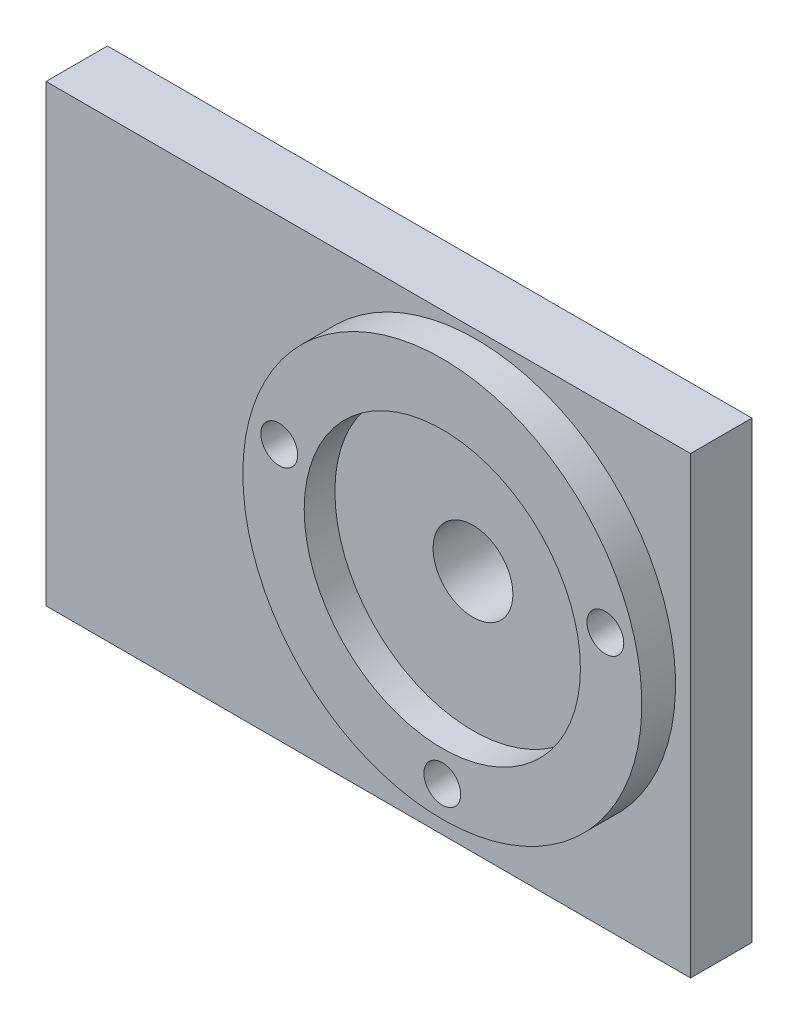
from build123d import *

# Parameters (mm, degrees)
ESQUISSE1_R                                  = 32.5
BOSS_EXTRU_1_DEPTH                           = 5
ESQUISSE2_R                                  = 22.5
ENL_V_MAT_EXTRU_1_DEPTH                      = 2.5
ESQUISSE3_R                                  = 6.5
ENL_V_MAT_EXTRU_2_DEPTH                      = 47.029881599
TROUS_DE_CENTRAGE_6_0MM1_D                   = 6
ESQUISSE6_W                                  = 105
ESQUISSE6_H                                  = 74
ESQUISSE6_R                                  = 32.5
BOSS_EXTRU_2_DEPTH                           = 10
ESQUISSE7_R                                  = 32.5
ESQUISSE7_R_2                                = 3
ESQUISSE7_R_3                                = 22.5
BOSS_EXTRU_3_DEPTH                           = 10.5
CHAMBRAGE_POUR_VIS_T_TE_RONDE_BOMB_2_COUNT   = 2
CHAMBRAGE_POUR_VIS_T_TE_RONDE_BOMB_2_PITCH   = 43.634433716
CHAMBRAGE_POUR_VIS_T_TE_RONDE_BOMB_3_COUNT   = 2
CHAMBRAGE_POUR_VIS_T_TE_RONDE_BOMB_3_PITCH   = 43.634433716
ESQUISSE16_R                                 = 6.5
BOSS_EXTRU_4_DEPTH                           = 8
CHAMBRAGE_POUR_VIS_T_TE_RONDE_BOMB_5_A_COUNT = 2
CHAMBRAGE_POUR_VIS_T_TE_RONDE_BOMB_5_A_PITCH = 43.634433716
D_GAGEMENT_M33_D                             = 3.4
D_GAGEMENT_M33_DEPTH                         = 5
D_GAGEMENT_M33_TIP                           = 0.981495458
D_GAGEMENT_M42_D                             = 4.5
D_GAGEMENT_M42_DEPTH                         = 5
D_GAGEMENT_M42_TIP                           = 1.299038106
D_GAGEMENT_M43_D                             = 4.5
D_GAGEMENT_M43_DEPTH                         = 5
D_GAGEMENT_M43_TIP                           = 1.299038106
D_GAGEMENT_M44_D                             = 4.5
D_GAGEMENT_M44_DEPTH                         = 5
D_GAGEMENT_M44_TIP                           = 1.299038106
D_GAGEMENT_M45_D                             = 4.5
D_GAGEMENT_M45_DEPTH                         = 3
D_GAGEMENT_M45_TIP                           = 1.299038106


with BuildPart() as part:
    # Esquisse1 → Boss.-Extru.1 (new body)
    with BuildSketch(Plane.XY):
        Circle(ESQUISSE1_R)
    extrude(amount=BOSS_EXTRU_1_DEPTH)

    # Esquisse2 → Enlèv. mat.-Extru.1 (cut)
    with BuildSketch(Plane.XY.offset(5)):
        Circle(ESQUISSE2_R)
    extrude(amount=-ENL_V_MAT_EXTRU_1_DEPTH, mode=Mode.SUBTRACT)

    # Esquisse3 → Enlèv. mat.-Extru.2 (cut, through all)
    with BuildSketch(Plane.XY.offset(2.5)):
        Circle(ESQUISSE3_R)
    extrude(amount=-ENL_V_MAT_EXTRU_2_DEPTH, mode=Mode.SUBTRACT)

    # Trous de centrage Ø6.0mm1 (through all)
    with Locations(Plane.XY.offset(5)):
        with Locations((0, -27.5), (-26.562960223, 7.11752374), (26.562960223, 7.11752374)):
            Hole(TROUS_DE_CENTRAGE_6_0MM1_D / 2)

    # Esquisse6 → Boss.-Extru.2 (add)
    with BuildSketch(Plane(origin=(0, 0, 0), x_dir=(-1, 0, 0), z_dir=(0, 0, -1))):
        with Locations((17.555230344, -3.167731133)):
            Rectangle(ESQUISSE6_W, ESQUISSE6_H)
        Circle(ESQUISSE6_R, mode=Mode.SUBTRACT)
    extrude(amount=-BOSS_EXTRU_2_DEPTH)

    # Esquisse7 → Boss.-Extru.3 (add)
    with BuildSketch(Plane.XY.offset(5)):
        with Locations(Location((0, 0, 0), (0, 0, 180))):
            Circle(ESQUISSE7_R)
        with Locations((0, -27.5)):
            Circle(ESQUISSE7_R_2, mode=Mode.SUBTRACT)
        with Locations((-26.562960223, 7.11752374)):
            Circle(ESQUISSE7_R_2, mode=Mode.SUBTRACT)
        Circle(ESQUISSE7_R_3, mode=Mode.SUBTRACT)
        with Locations((26.562960223, 7.11752374)):
            Circle(ESQUISSE7_R_2, mode=Mode.SUBTRACT)
    extrude(amount=BOSS_EXTRU_3_DEPTH)

    # Esquisse14 → Chambrage pour vis _ t_te ronde bomb_e M (revolve, cut)
    with BuildSketch(Plane(origin=(0, -27.5, 0), x_dir=(0, 1, 0), z_dir=(1, 0, 0))):
        Polygon((0, 0), (0, 6.982840043), (3.3, 5), (3.3, 4.625), (3.325, 4.6), (6.5, 4.6), (6.5, 0), align=None)
    chambrage_pour_vis_t_te_ronde_bomb_e_m = revolve(axis=Axis((0, -27.5, -6.35), (0, 0, 1)), mode=Mode.SUBTRACT)

    # Chambrage pour vis _ t_te ronde bomb 2: Chambrage pour vis _ t_te ronde bomb_e M ×2
    with Locations(*[Vector(-0.6087614290087126, 0.7933533402912415, 0) * (i * CHAMBRAGE_POUR_VIS_T_TE_RONDE_BOMB_2_PITCH) for i in range(1, CHAMBRAGE_POUR_VIS_T_TE_RONDE_BOMB_2_COUNT)]):
        add(chambrage_pour_vis_t_te_ronde_bomb_e_m, mode=Mode.SUBTRACT)

    # Chambrage pour vis _ t_te ronde bomb 3: Chambrage pour vis _ t_te ronde bomb_e M ×2
    with Locations(*[Vector(0.6087614290087182, 0.793353340291237, 0) * (i * CHAMBRAGE_POUR_VIS_T_TE_RONDE_BOMB_3_PITCH) for i in range(1, CHAMBRAGE_POUR_VIS_T_TE_RONDE_BOMB_3_COUNT)]):
        add(chambrage_pour_vis_t_te_ronde_bomb_e_m, mode=Mode.SUBTRACT)

    # Esquisse16 → Boss.-Extru.4 (add)
    # profile 1 of 4: a face of its own
    with BuildSketch(Plane.XY.offset(2.5)):
        with BuildLine():
            ThreePointArc((-22.399321758, 2.126119656), (-17.850450157, -13.697132153), (-3.743697183, -22.186363636))
            ThreePointArc((-3.743697183, -22.186363636), (0, -21), (3.743697183, -22.186363636))
            ThreePointArc((3.743697183, -22.186363636), (17.850450157, -13.697132153), (22.399321758, 2.126119656))
            ThreePointArc((22.399321758, 2.126119656), (20.284442352, 5.435199947), (20.461441498, 9.358387245))
            ThreePointArc((20.461441498, 9.358387245), (0, 22.5), (-20.461441498, 9.358387245))
            ThreePointArc((-20.461441498, 9.358387245), (-20.284442352, 5.435199947), (-22.399321758, 2.126119656))
        make_face()
        Circle(ESQUISSE16_R, mode=Mode.SUBTRACT)
    # profile 2 of 4: a face of its own
    with BuildSketch(Plane.XY.offset(2.5)):
        with BuildLine():
            ThreePointArc((20.461441498, 9.358387245), (20.284442352, 5.435199947), (22.399321758, 2.126119656))
            ThreePointArc((22.399321758, 2.126119656), (21.733331092, 5.823428515), (20.461441498, 9.358387245))
        make_face()
    # profile 3 of 4: a face of its own
    with BuildSketch(Plane.XY.offset(2.5)):
        with BuildLine():
            ThreePointArc((-3.743697183, -22.186363636), (0, -22.5), (3.743697183, -22.186363636))
            ThreePointArc((3.743697183, -22.186363636), (0, -21), (-3.743697183, -22.186363636))
        make_face()
    # profile 4 of 4: a face of its own
    with BuildSketch(Plane.XY.offset(2.5)):
        with BuildLine():
            ThreePointArc((-22.399321758, 2.126119656), (-20.284442352, 5.435199947), (-20.461441498, 9.358387245))
            ThreePointArc((-20.461441498, 9.358387245), (-21.733331092, 5.823428515), (-22.399321758, 2.126119656))
        make_face()
    extrude(amount=BOSS_EXTRU_4_DEPTH)

    # Esquisse17 → Chambrage pour vis _ t_te ronde bomb 4 (revolve, cut)
    with BuildSketch(Plane(origin=(-26.562960223, 7.11752374, 0), x_dir=(0, 1, 0), z_dir=(1, 0, 0))):
        Polygon((0, 0), (0, 6.982840043), (3.3, 5), (3.3, 4.625), (3.325, 4.6), (6.5, 4.6), (6.5, 0), align=None)
    revolve(axis=Axis((-26.562960223, 7.11752374, -6.35), (0, 0, 1)), mode=Mode.SUBTRACT)

    # Esquisse19 → Chambrage pour vis _ t_te ronde bomb 5 (revolve, cut)
    with BuildSketch(Plane(origin=(0, -27.5, 0), x_dir=(0, 1, 0), z_dir=(1, 0, 0))):
        Polygon((0, 0), (0, 6.982840043), (3.3, 5), (3.3, 4.625), (3.325, 4.6), (6.5, 4.6), (6.5, 0), align=None)
    chambrage_pour_vis_t_te_ronde_bomb_5 = revolve(axis=Axis((0, -27.5, -6.35), (0, 0, 1)), mode=Mode.SUBTRACT)

    # Chambrage pour vis _ t_te ronde bomb 5 a: Chambrage pour vis _ t_te ronde bomb 5 ×2
    with Locations(*[Vector(0.6087614290087182, 0.793353340291237, 0) * (i * CHAMBRAGE_POUR_VIS_T_TE_RONDE_BOMB_5_A_PITCH) for i in range(1, CHAMBRAGE_POUR_VIS_T_TE_RONDE_BOMB_5_A_COUNT)]):
        add(chambrage_pour_vis_t_te_ronde_bomb_5, mode=Mode.SUBTRACT)

    # Dégagement M33
    with Locations(Plane(origin=(0, 0, 0), x_dir=(-1, 0, 0), z_dir=(0, 0, -1))):
        with Locations((55.547535515, -22.294087775), (36.229018989, -17.117706873), (55.547535515, 22.294087775), (36.229018989, 17.117706873), (38.2648555, 10.872157738), (30.699885045, 25.058257509), (37.238947698, 26.810394066), (38.2648555, -10.872157738), (37.238947698, -26.810394066), (30.699885045, -25.058257509), (62.293797593, 3.775), (62.293797593, -3.775)):
            Hole(D_GAGEMENT_M33_D / 2, depth=D_GAGEMENT_M33_DEPTH)
            with Locations((0, 0, -(D_GAGEMENT_M33_DEPTH + D_GAGEMENT_M33_TIP / 2))):  # 120° drill point
                Cone(0, D_GAGEMENT_M33_D / 2, D_GAGEMENT_M33_TIP, mode=Mode.SUBTRACT)

    # Dégagement M42
    with Locations(Plane(origin=(0, 0, 0), x_dir=(-1, 0, 0), z_dir=(0, 0, -1))):
        with Locations((38.293797593, 0)):
            Hole(D_GAGEMENT_M42_D / 2, depth=D_GAGEMENT_M42_DEPTH)
            with Locations((0, 0, -(D_GAGEMENT_M42_DEPTH + D_GAGEMENT_M42_TIP / 2))):  # 120° drill point
                Cone(0, D_GAGEMENT_M42_D / 2, D_GAGEMENT_M42_TIP, mode=Mode.SUBTRACT)

    # Dégagement M43
    with Locations(Plane(origin=(0, 0, 0), x_dir=(-1, 0, 0), z_dir=(0, 0, -1))):
        with Locations((62.420130644, 28.906134766)):
            Hole(D_GAGEMENT_M43_D / 2, depth=D_GAGEMENT_M43_DEPTH)
            with Locations((0, 0, -(D_GAGEMENT_M43_DEPTH + D_GAGEMENT_M43_TIP / 2))):  # 120° drill point
                Cone(0, D_GAGEMENT_M43_D / 2, D_GAGEMENT_M43_TIP, mode=Mode.SUBTRACT)

    # Dégagement M44
    with Locations(Plane(origin=(0, 0, 0), x_dir=(-1, 0, 0), z_dir=(0, 0, -1))):
        with Locations((61.930509464, -28.264433855)):
            Hole(D_GAGEMENT_M44_D / 2, depth=D_GAGEMENT_M44_DEPTH)
            with Locations((0, 0, -(D_GAGEMENT_M44_DEPTH + D_GAGEMENT_M44_TIP / 2))):  # 120° drill point
                Cone(0, D_GAGEMENT_M44_D / 2, D_GAGEMENT_M44_TIP, mode=Mode.SUBTRACT)

    # Dégagement M45
    with Locations(Plane(origin=(0, 0, 0), x_dir=(-1, 0, 0), z_dir=(0, 0, -1))):
        with Locations((23.628478868, -35.912807339), (23.628478868, 29.577345073), (-29.371521132, 29.577345073), (-29.371521132, -35.912807339)):
            Hole(D_GAGEMENT_M45_D / 2, depth=D_GAGEMENT_M45_DEPTH)
            with Locations((0, 0, -(D_GAGEMENT_M45_DEPTH + D_GAGEMENT_M45_TIP / 2))):  # 120° drill point
                Cone(0, D_GAGEMENT_M45_D / 2, D_GAGEMENT_M45_TIP, mode=Mode.SUBTRACT)


solid = part.part
